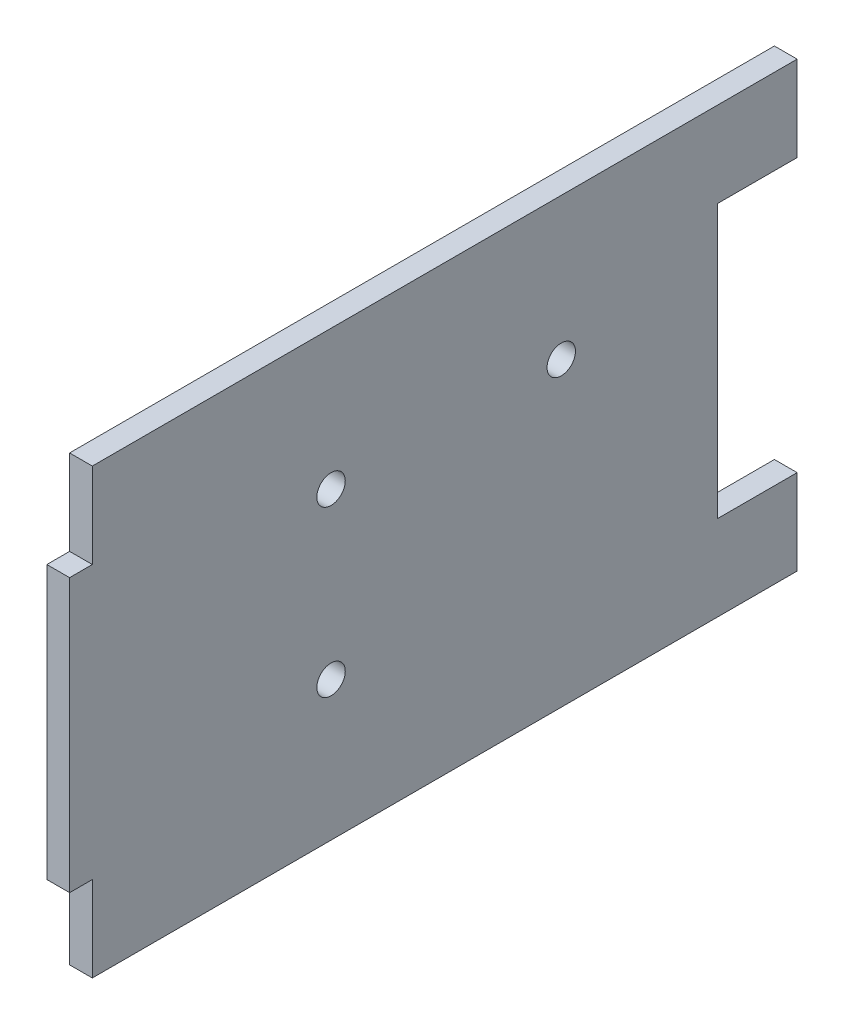
from build123d import *

# Parameters (mm, degrees)
BOSS_EXTRUDE1_DEPTH = 4
SKETCH2_R           = 2.5
CUT_EXTRUDE1_DEPTH  = 147.546920814


with BuildPart() as part:
    # Sketch1 → Boss-Extrude1 (new body)
    with BuildSketch(Plane(origin=(0, 0, 0), x_dir=(0, 0, -1), z_dir=(1, 0, 0))):
        Polygon((0, 63), (0, 78), (124, 78), (124, 63), (110, 63), (110, 15), (124, 15), (124, 0), (0, 0), (0, 15), (-4, 15), (-4, 63), align=None)
    extrude(amount=BOSS_EXTRUDE1_DEPTH)

    # Sketch2 → Cut-Extrude1 (cut, through all)
    with BuildSketch(Plane(origin=(4, 0, 0), x_dir=(0, 0, -1), z_dir=(1, 0, 0))):
        with Locations((42, 24.5)):
            Circle(SKETCH2_R)
        with Locations((42, 53.5)):
            Circle(SKETCH2_R)
        with Locations((82.5, 53)):
            Circle(SKETCH2_R)
    extrude(amount=-CUT_EXTRUDE1_DEPTH, mode=Mode.SUBTRACT)


solid = part.part
